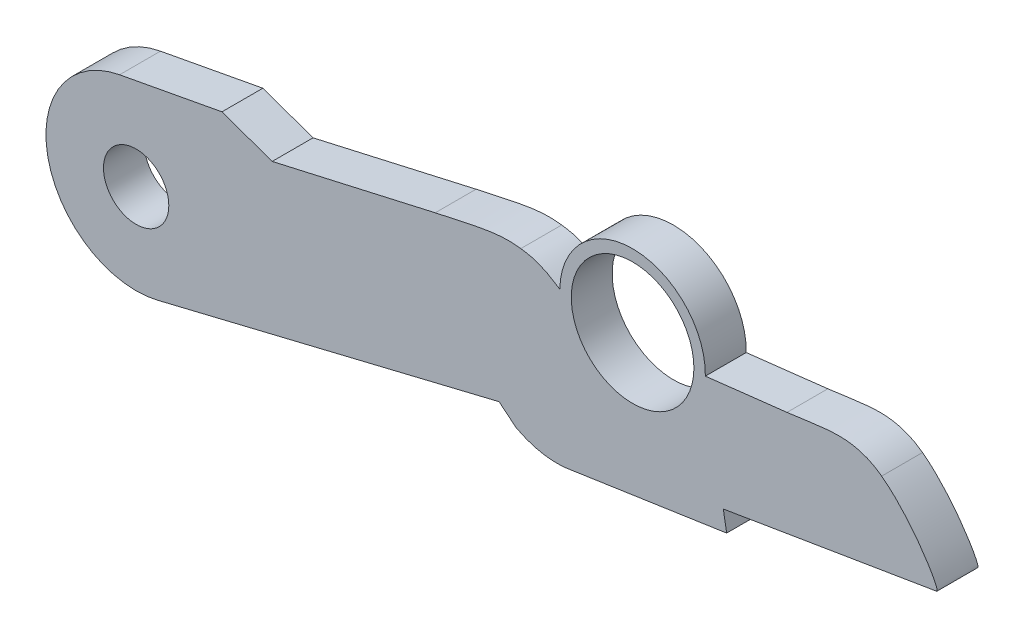
from build123d import *

# Parameters (mm, degrees)
SKETCH1_R           = 1.598426077
SKETCH1_R_2         = 3
BOSS_EXTRUDE1_DEPTH = 2
SCALE1_SCALE        = 2.8


with BuildPart() as part:
    # Sketch1 → Boss-Extrude1 (new body)
    with BuildSketch(Plane.XY):
        with BuildLine():
            Line((-185.215931952, 133.947260869), (-185.213664396, 133.947234502))
            Line((-185.213664396, 133.947234502), (-181.222608058, 134.40739012))
            add(Edge.make_bspline(
                [(-181.222608058, 134.40739012), (-179.470077492, 134.609439885), (-178.007424926, 135.082040692), (-176.58956977, 134.02354039)],
                knots=[0.1, 0.1, 0.1, 0.1, 0.133333333, 0.133333333, 0.133333333, 0.133333333], degree=3))
            add(Edge.make_bspline(
                [(-176.58956977, 134.02354039), (-175.053406211, 132.876684515), (-173.674389539, 130.527654949), (-173.900512309, 130.490108445)],
                knots=[0.133333333, 0.133333333, 0.133333333, 0.133333333, 0.166666667, 0.166666667, 0.166666667, 0.166666667], degree=3))
            Line((-173.900512309, 130.490108445), (-184.336884958, 128.757089405))
            Line((-184.336884958, 128.757089405), (-184.173119971, 127.817925817))
            Line((-184.173119971, 127.817925817), (-192.016779912, 126.651189278))
            add(Edge.make_bspline(
                [(-192.016779912, 126.651189278), (-192.907955692, 126.552708804), (-193.71626022, 126.739571219), (-194.466926644, 127.127560556)],
                knots=[0.266666667, 0.266666667, 0.266666667, 0.266666667, 0.3, 0.3, 0.3, 0.3], degree=3))
            Line((-194.466926644, 127.127560556), (-195.306587773, 127.817925817))
            Line((-195.306587773, 127.817925817), (-212.023872072, 123.761509934))
            ThreePointArc((-212.023872072, 123.761509934), (-217.37856884, 127.123951805), (-213.87424985, 132.386892164))
            Line((-213.87424985, 132.386892164), (-208.863883058, 133.322461629))
            Line((-208.863883058, 133.322461629), (-206.408455346, 132.448142845))
            Line((-206.408455346, 132.448142845), (-198.430956882, 134.26057907))
            add(Edge.make_bspline(
                [(-198.430956882, 134.26057907), (-196.41657636, 134.684664731), (-195.322164303, 134.996216346), (-194.244996216, 134.835931794)],
                knots=[0.833333333, 0.833333333, 0.833333333, 0.833333333, 0.866666667, 0.866666667, 0.866666667, 0.866666667], degree=3))
            add(Edge.make_bspline(
                [(-194.244996216, 134.835931794), (-193.666057591, 134.749817409), (-193.283526207, 134.691889269), (-192.335160561, 134.072002805)],
                knots=[0.866666667, 0.866666667, 0.866666667, 0.866666667, 0.9, 0.9, 0.9, 0.9], degree=3))
            ThreePointArc((-192.335160561, 134.072002805), (-188.713175288, 137.569246142), (-185.215931952, 133.947260869))
        make_face()
        with Locations((-213.064337356, 128.049471145)):
            Circle(SKETCH1_R, mode=Mode.SUBTRACT)
        with Locations((-188.775546256, 134.009631837)):
            Circle(SKETCH1_R_2, mode=Mode.SUBTRACT)
    extrude(amount=BOSS_EXTRUDE1_DEPTH)


with BuildPart() as part_1:
    # Scale1: scaled about (-197.812909455, 130.051467898, 1)
    add(part.part.scale(SCALE1_SCALE).moved(Location((356.063237019, -234.092642216, -1.8))))


solid = part_1.part
